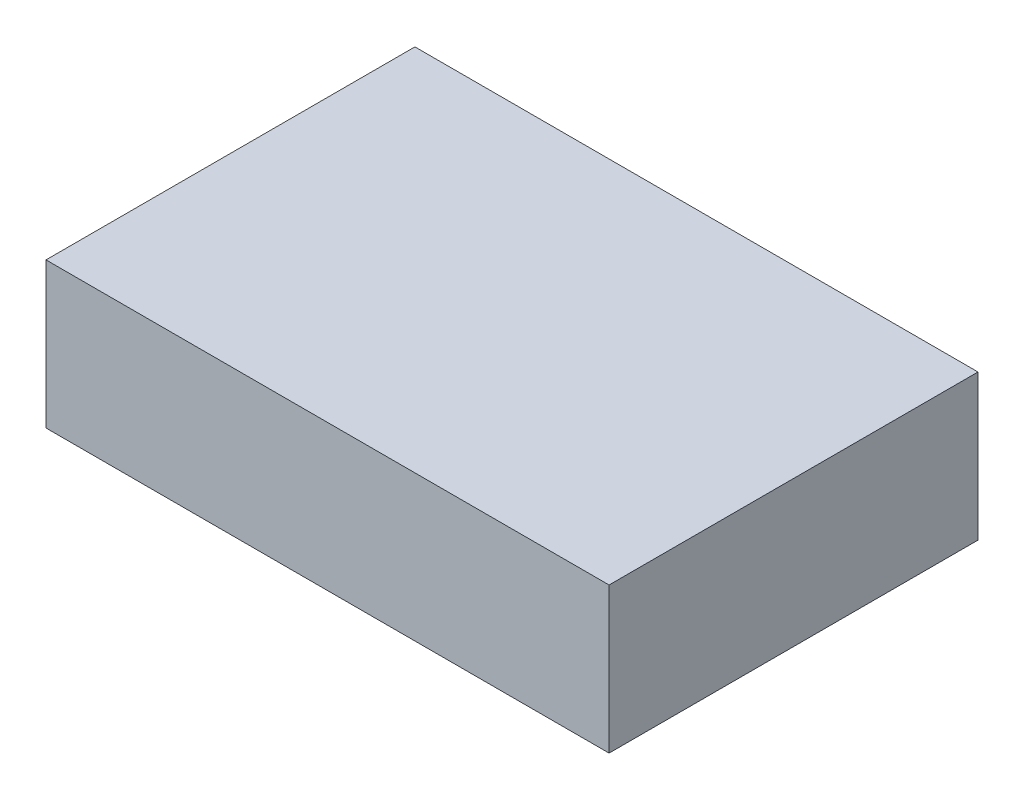
from build123d import *

# Parameters (mm, degrees)
SKETCH1_W           = 58
SKETCH1_H           = 38
BOSS_EXTRUDE1_DEPTH = 15


with BuildPart() as part:
    # Sketch1 → Boss-Extrude1 (new body)
    with BuildSketch(Plane(origin=(0, 0, 0), x_dir=(1, 0, 0), z_dir=(0, 1, 0))):
        with Locations((29, -19)):
            Rectangle(SKETCH1_W, SKETCH1_H)
    extrude(amount=BOSS_EXTRUDE1_DEPTH)


solid = part.part
